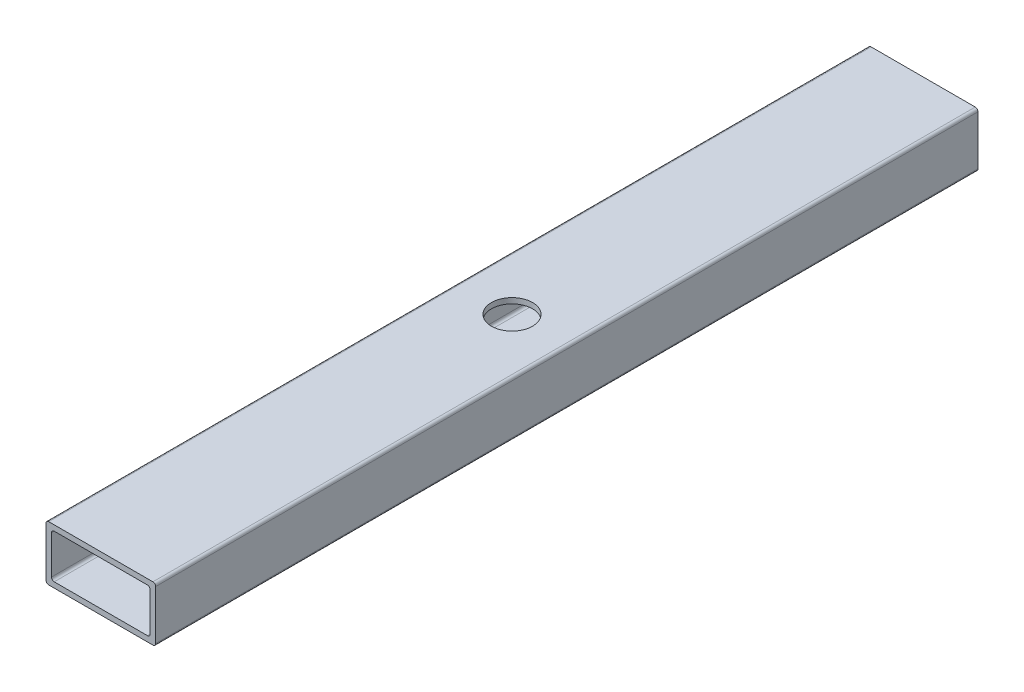
from build123d import *

# Parameters (mm, degrees)
BOSS_EXTRU_1_DEPTH      = 600
ESQUISSE2_R             = 15
ENL_V_MAT_EXTRU_1_DEPTH = 607.630035524


with BuildPart() as part:
    # Esquisse1 → Boss.-Extru.1 (new body)
    with BuildSketch(Plane.XY):
        with BuildLine():
            Line((2, -2), (78, -2))
            ThreePointArc((78, -2), (79.414213562, -1.414213562), (80, 0))
            Line((80, 0), (80, 36))
            ThreePointArc((80, 36), (79.414213562, 37.414213562), (78, 38))
            Line((78, 38), (2, 38))
            ThreePointArc((2, 38), (0.585786438, 37.414213562), (0, 36))
            Line((0, 36), (0, 0))
            ThreePointArc((0, 0), (0.585786438, -1.414213562), (2, -2))
        make_face()
        with BuildLine():
            Line((4, 4), (4, 32))
            ThreePointArc((4, 32), (4.585786438, 33.414213562), (6, 34))
            Line((6, 34), (74, 34))
            ThreePointArc((74, 34), (75.414213562, 33.414213562), (76, 32))
            Line((76, 32), (76, 4))
            ThreePointArc((76, 4), (75.414213562, 2.585786438), (74, 2))
            Line((74, 2), (6, 2))
            ThreePointArc((6, 2), (4.585786438, 2.585786438), (4, 4))
        make_face(mode=Mode.SUBTRACT)
    extrude(amount=BOSS_EXTRU_1_DEPTH)

    # Esquisse2 → Enlèv. mat.-Extru.1 (cut, through all)
    with BuildSketch(Plane(origin=(0, 38, 0), x_dir=(1, 0, 0), z_dir=(0, 1, 0))):
        with Locations(Location((40, -300, 0), (0, 0, 180))):
            Circle(ESQUISSE2_R)
    extrude(amount=-ENL_V_MAT_EXTRU_1_DEPTH, mode=Mode.SUBTRACT)


solid = part.part
